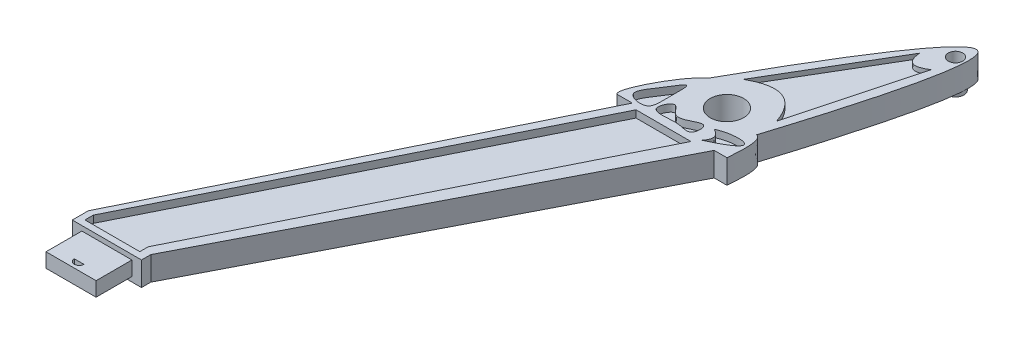
from build123d import *
from build123d.topology import SkipClean

# Parameters (mm, degrees)
SKETCH_1_R          = 7
SKETCH_1_R_2        = 3
EXTRUDE_2_DEPTH     = 10
CUT_EXTRUDE_1_DEPTH = 3
CUT_EXTRUDE_3_DEPTH = 3
SKETCH_13_W         = 20.948283726
SKETCH_13_H         = 6
EXTRUDE_3_DEPTH     = 15
CUT_EXTRUDE_4_DEPTH = 6
CUT_EXTRUDE_5_DEPTH = 2
EXTRUDE_START       = 2
SKETCH_20_R         = 3.5
SKETCH_20_R_2       = 3
EXTRUDE_5_DEPTH     = 2


with BuildPart() as part:
    # 草图1 → 凸台-拉伸2 (new body)
    # profile 1 of 3: a face of its own
    with BuildSketch(Plane(origin=(0, 0, 0), x_dir=(1, 0, 0), z_dir=(0, 1, 0))):
        Polygon((34.281930709, 0), (0, 0), (-74.75741082, -152.830674539), (-74.75741082, -159.49410796), (-45.809127094, -159.49410796), (-45.809127094, -155.59698731), align=None)
    # profile 2 of 3: a face of its own
    with BuildSketch(Plane(origin=(0, 0, 0), x_dir=(1, 0, 0), z_dir=(0, 1, 0))):
        with BuildLine():
            Line((-6.412858529, 0), (0, 0))
            Line((0, 0), (34.281930709, 0))
            Line((34.281930709, 0), (39.621642464, 0))
            add(Edge.make_bspline(
                [(37.497488656, 14.514369036), (39.661980906, 13.978790975), (40.525366445, 10.302075865), (39.621642464, 0)],
                knots=[0.85434374, 0.85434374, 0.85434374, 0.85434374, 1, 1, 1, 1], degree=3))
            add(Edge.make_bspline(
                [(6.85328508, 24.845771089), (7.454313764, 25.164340279), (10.257754605, 25.308838797), (6.736264005, 5.629846067), (25.940678071, 7.194028547), (34.715181248, 15.202818165), (37.497488656, 14.514369036)],
                knots=[0.3018346, 0.3018346, 0.3018346, 0.3018346, 0.340384542, 0.521252993, 0.667112536, 0.85434374, 0.85434374, 0.85434374, 0.85434374], degree=3))
            add(Edge.make_bspline(
                [(-6.412858529, 0), (-9.20924404, 1.883861849), (2.14740891, 22.351468907), (6.85328508, 24.845771089)],
                knots=[0, 0, 0, 0, 0.3018346, 0.3018346, 0.3018346, 0.3018346], degree=3))
        make_face()
    # profile 3 of 3: a face of its own
    with BuildSketch(Plane(origin=(0, 0, 0), x_dir=(1, 0, 0), z_dir=(0, 1, 0))):
        with BuildLine():
            add(Edge.make_bspline(
                [(6.85328508, 24.845771089), (83.948337953, 162.943574617), (37.497488656, 14.514369036)],
                knots=[0, 0, 0, 1, 1, 1], degree=2))
            add(Edge.make_bspline(
                [(6.85328508, 24.845771089), (7.454313764, 25.164340279), (10.257754605, 25.308838797), (6.736264005, 5.629846067), (25.940678071, 7.194028547), (34.715181248, 15.202818165), (37.497488656, 14.514369036)],
                knots=[0.3018346, 0.3018346, 0.3018346, 0.3018346, 0.340384542, 0.521252993, 0.667112536, 0.85434374, 0.85434374, 0.85434374, 0.85434374], degree=3))
        make_face()
        with Locations(Location((21.623204814, 17.978404966, 0), (0, 0, 270))):
            Circle(SKETCH_1_R, mode=Mode.SUBTRACT)
        with Locations(Location((50.943840314, 84.2657022, 0), (0, 0, 270))):
            Circle(SKETCH_1_R_2, mode=Mode.SUBTRACT)
    extrude(amount=EXTRUDE_2_DEPTH)

    # 草图2 → 切除-拉伸1 (cut)
    with BuildSketch(Plane(origin=(0, 10, 0), x_dir=(1, 0, 0), z_dir=(0, 1, 0))):
        with BuildLine():
            add(Edge.make_bspline(
                [(4.964790135, 17.773312955), (4.153246505, 18.118443099), (0.0736862, 10.570640486), (-6.163403671, 2.677506419), (6.309148791, 0.158088186), (5.086264962, 9.352661934), (5.725008414, 17.450010259), (4.964790135, 17.773312955)],
                knots=[0, 0, 0, 0, 0.210594132, 0.423111279, 0.592783883, 0.802724706, 1, 1, 1, 1], degree=3))
        make_face()
        with BuildLine():
            add(Edge.make_bspline(
                [(9.299576658, 8.280679177), (10.70945689, 8.477667133), (13.927436248, 0.325295304), (24.185955373, 11.186553751), (23.86672185, 0.137701725), (17.001653264, 2.545418566), (12.74483826, 1.700430187), (4.90967236, 1.956915895), (7.898147864, 8.084872053), (9.299576658, 8.280679177)],
                knots=[0, 0, 0, 0, 0.134824124, 0.368001771, 0.480860587, 0.59465538, 0.754229687, 0.865984071, 1, 1, 1, 1], degree=3))
        make_face()
        with BuildLine():
            add(Edge.make_bspline(
                [(26.693593465, 7.622230591), (31.575046141, 5.109380188), (27.900749206, 1.037744734)],
                knots=[0, 0, 0, 1, 1, 1], degree=2))
            add(Edge.make_bspline(
                [(26.693593465, 7.622230591), (32.230916242, 10.744775729), (49.593001909, 10.794597933), (27.900749206, 1.037744734)],
                knots=[0, 0, 0, 0, 1, 1, 1, 1], degree=3))
        make_face()
    cut_extrude_1 = extrude(amount=-CUT_EXTRUDE_1_DEPTH, mode=Mode.SUBTRACT)

    # 镜向1: 切除-拉伸1 across plane
    add(cut_extrude_1.mirror(Plane.ZX.offset(5)), mode=Mode.SUBTRACT)

    # 草图12 → 切除-拉伸3 (cut)
    with BuildSketch(Plane(origin=(0, 10, 0), x_dir=(1, 0, 0), z_dir=(0, 1, 0))):
        Polygon((3.22085578, -1.654712908), (26.178201806, -1.654712908), (-49.183248008, -153.325693041), (-49.183248008, -156.825693041), (-72.140594034, -156.825693041), (-72.140594034, -153.325693041), align=None)
    cut_extrude_3 = extrude(amount=-CUT_EXTRUDE_3_DEPTH, mode=Mode.SUBTRACT)

    # 镜向2: 切除-拉伸3 across plane
    add(cut_extrude_3.mirror(Plane.ZX.offset(5)), mode=Mode.SUBTRACT)

    # 草图13 → 凸台-拉伸3 (add)
    with BuildSketch(Plane.XY.offset(159.49410796)):
        with Locations((-60.283268957, 5)):
            Rectangle(SKETCH_13_W, SKETCH_13_H)
    extrude(amount=EXTRUDE_3_DEPTH)

    # 草图16 → 切除-拉伸4 (cut)
    with BuildSketch(Plane(origin=(0, 8, 0), x_dir=(1, 0, 0), z_dir=(0, 1, 0))):
        with BuildLine():
            Line((-62.283268957, -171.117934411), (-58.283268957, -171.117934411))
            ThreePointArc((-58.283268957, -171.117934411), (-60.283268957, -173.117934411), (-62.283268957, -171.117934411))
        make_face()
    extrude(amount=-CUT_EXTRUDE_4_DEPTH, mode=Mode.SUBTRACT)

    # 草图17 → 切除-拉伸5 (cut)
    with BuildSketch(Plane(origin=(0, 10, 0), x_dir=(1, 0, 0), z_dir=(0, 1, 0))):
        with BuildLine():
            Line((42.026853455, 78.187228075), (14.65296552, 31.819213818))
            add(Edge.make_bspline(
                [(14.65296552, 31.819213818), (30.757188992, 40.948585223), (36.775536177, 23.551182361)],
                knots=[0, 0, 0, 1, 1, 1], degree=2))
            Line((36.775536177, 23.551182361), (50.406615067, 74.61186312))
            add(Edge.make_bspline(
                [(42.026853455, 78.187228075), (42.740822053, 69.583585768), (50.406615067, 74.61186312)],
                knots=[0, 0, 0, 1, 1, 1], degree=2))
        make_face()
    cut_extrude_5 = extrude(amount=-CUT_EXTRUDE_5_DEPTH, mode=Mode.SUBTRACT)

    # 镜向3: 切除-拉伸5 across plane
    add(cut_extrude_5.mirror(Plane.ZX.offset(5)), mode=Mode.SUBTRACT)

    # 草图20 → 凸台-拉伸5 (add)
    with SkipClean():  # the faces are left unmerged after this step: merging them gives an invalid solid
        with BuildSketch(Plane.XZ.offset(EXTRUDE_START)):
            with Locations(Location((50.943840314, -84.2657022, 0), (0, 0, 90))):
                Circle(SKETCH_20_R)
            with Locations(Location((50.943840314, -84.2657022, 0), (0, 0, 270))):
                Circle(SKETCH_20_R_2, mode=Mode.SUBTRACT)
        extrude(amount=-EXTRUDE_5_DEPTH)


solid = part.part
